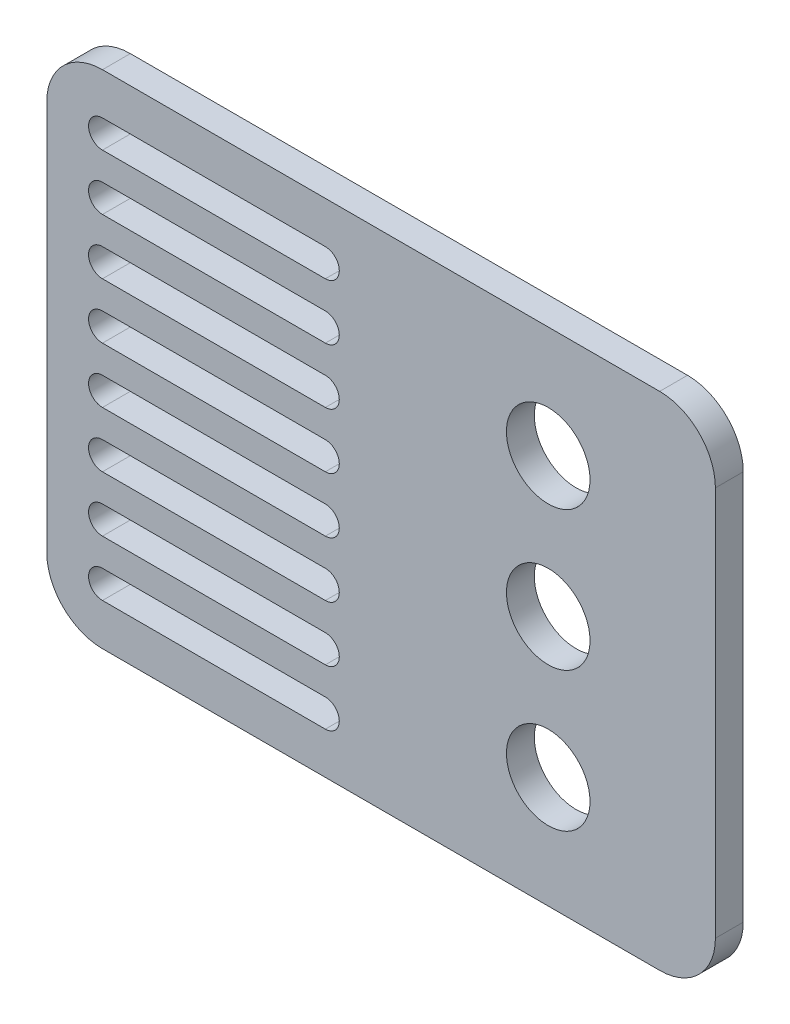
from build123d import *

# Parameters (mm, degrees)
SKETCH2_W             = 152.4
SKETCH2_H             = 114.3
BASE_EXTRUDE_DEPTH    = 6.35
FILLET_2_R            = 12.7
SKETCH3_R             = 9.525
CIRCULAR_CUT_DEPTH    = 96.461432003
SLOT_CUT_DEPTH        = 96.461432003
SLOT_LPATTERN_COUNT   = 8
SLOT_LPATTERN_PITCH   = 12.7
CIRCLE_LPATTERN_COUNT = 3
CIRCLE_LPATTERN_PITCH = 31.75


with BuildPart() as part:
    # Sketch2 → Base Extrude (new body)
    with BuildSketch(Plane.XY):
        Rectangle(SKETCH2_W, SKETCH2_H)
    extrude(amount=BASE_EXTRUDE_DEPTH)

    # Fillet 2
    fillet_2_edges = [part.edges().sort_by_distance(p)[0] for p in [
        (-76.2, 57.15, 3.175),
        (76.2, 57.15, 3.175),
        (76.2, -57.15, 3.175),
        (-76.2, -57.15, 3.175),
    ]]
    fillet(fillet_2_edges, radius=FILLET_2_R)

    # Sketch3 → Circular Cut (cut, through all)
    with BuildSketch(Plane.XY.offset(6.35)):
        with Locations((38.1, 31.75)):
            Circle(SKETCH3_R)
    circular_cut = extrude(amount=-CIRCULAR_CUT_DEPTH, mode=Mode.SUBTRACT)

    # Sketch5 → Slot Cut (cut, through all)
    with BuildSketch(Plane.XY.offset(6.35)):
        with BuildLine():
            Line((-63.5, 47.625), (-12.7, 47.625))
            ThreePointArc((-12.7, 47.625), (-9.525, 44.45), (-12.7, 41.275))
            Line((-12.7, 41.275), (-63.5, 41.275))
            ThreePointArc((-63.5, 41.275), (-66.675, 44.45), (-63.5, 47.625))
        make_face()
    slot_cut = extrude(amount=-SLOT_CUT_DEPTH, mode=Mode.SUBTRACT)

    # Slot LPattern: Slot Cut ×8
    with Locations(*[(0, -i * SLOT_LPATTERN_PITCH, 0) for i in range(1, SLOT_LPATTERN_COUNT)]):
        add(slot_cut, mode=Mode.SUBTRACT)

    # Circle LPattern: Circular Cut ×3
    with Locations(*[(0, -i * CIRCLE_LPATTERN_PITCH, 0) for i in range(1, CIRCLE_LPATTERN_COUNT)]):
        add(circular_cut, mode=Mode.SUBTRACT)


solid = part.part
